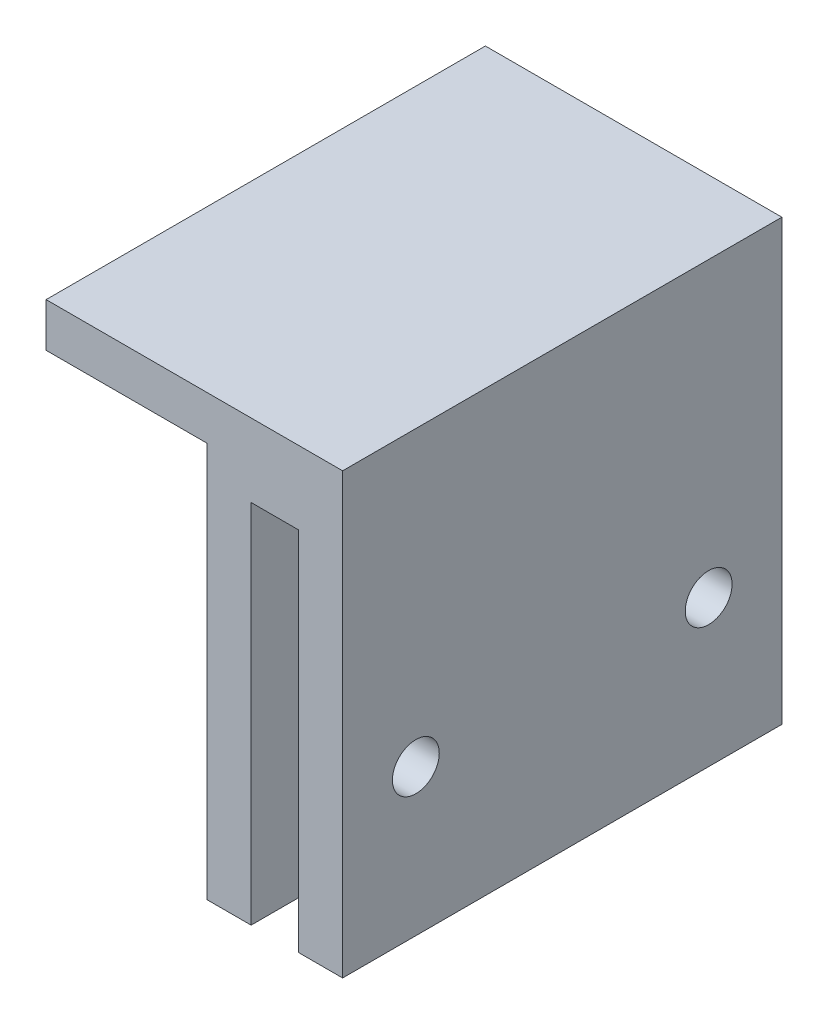
from build123d import *

# Parameters (mm, degrees)
SKETCH2_W           = 30
SKETCH2_H           = 30
SKETCH2_R           = 1.6
BOSS_EXTRUDE1_DEPTH = 9.25
SKETCH3_W           = 3.25
SKETCH3_H           = 25
CUT_EXTRUDE1_DEPTH  = 44.423064148
SKETCH5_W           = 30
SKETCH5_H           = 3
BOSS_EXTRUDE2_DEPTH = 11


with BuildPart() as part:
    # Sketch2 → Boss-Extrude1 (new body)
    with BuildSketch(Plane(origin=(0, 0, 0), x_dir=(0, 0, -1), z_dir=(1, 0, 0))):
        with Locations((15, 15)):
            Rectangle(SKETCH2_W, SKETCH2_H)
        with Locations((5, 10)):
            Circle(SKETCH2_R, mode=Mode.SUBTRACT)
        with Locations((25, 10)):
            Circle(SKETCH2_R, mode=Mode.SUBTRACT)
    extrude(amount=-BOSS_EXTRUDE1_DEPTH)

    # Sketch3 → Cut-Extrude1 (cut, through all)
    with BuildSketch(Plane.XY):
        with Locations((-4.625, 12.5)):
            Rectangle(SKETCH3_W, SKETCH3_H)
    extrude(amount=-CUT_EXTRUDE1_DEPTH, mode=Mode.SUBTRACT)

    # Sketch5 → Boss-Extrude2 (add)
    with BuildSketch(Plane.ZY.offset(9.25)):
        with Locations((-15, 28.5)):
            Rectangle(SKETCH5_W, SKETCH5_H)
    extrude(amount=BOSS_EXTRUDE2_DEPTH)


solid = part.part
